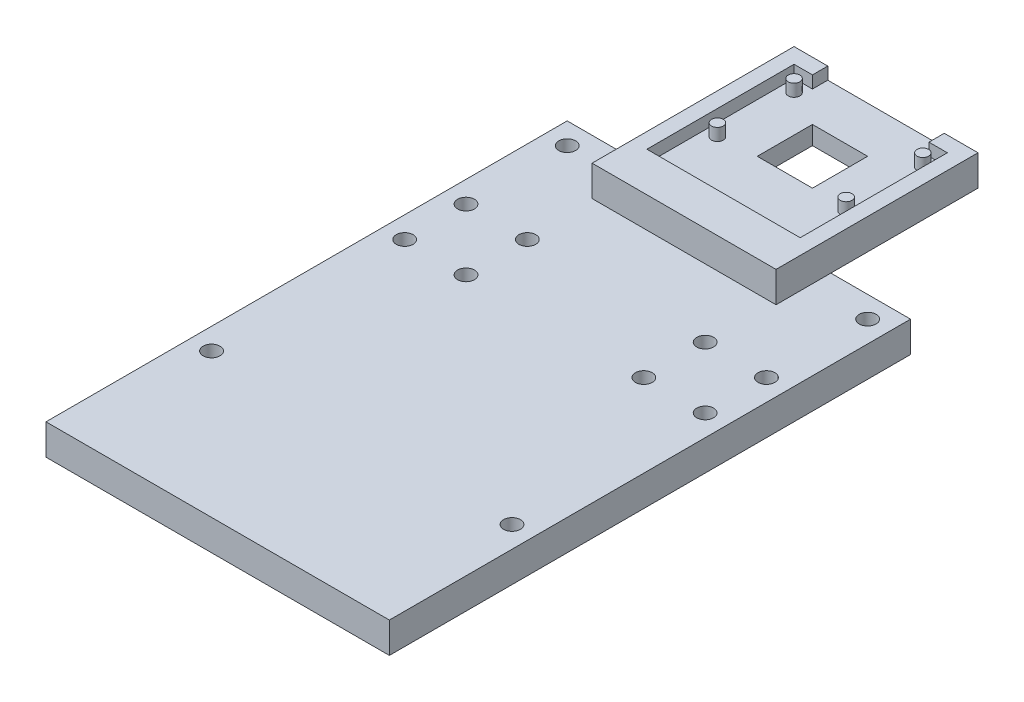
from build123d import *

# Parameters (mm, degrees)
SKETCH1_W           = 56
SKETCH1_H           = 85
BOSS_EXTRUDE1_DEPTH = 5
SKETCH2_R           = 1.375
CUT_EXTRUDE1_DEPTH  = 5
SKETCH3_R           = 1.375
CUT_EXTRUDE2_DEPTH  = 5
SKETCH5_W           = 30
SKETCH5_H           = 8.938360197
BOSS_EXTRUDE2_DEPTH = 5
SKETCH6_W           = 30
SKETCH6_H           = 5
BOSS_EXTRUDE3_DEPTH = 24
CUT_EXTRUDE3_DEPTH  = 2
SKETCH9_W           = 9
SKETCH9_H           = 9
CUT_EXTRUDE4_DEPTH  = 3
SKETCH10_R          = 0.95
BOSS_EXTRUDE4_DEPTH = 2


with BuildPart() as part:
    # Sketch1 → Boss-Extrude1 (new body)
    with BuildSketch(Plane(origin=(0, 0, 0), x_dir=(1, 0, 0), z_dir=(0, 1, 0))):
        with Locations((-25.952095808, 2.54491018)):
            Rectangle(SKETCH1_W, SKETCH1_H)
    extrude(amount=BOSS_EXTRUDE1_DEPTH)

    # Sketch2 → Cut-Extrude1 (cut)
    with BuildSketch(Plane(origin=(0, 0, 0), x_dir=(-1, 0, 0), z_dir=(0, -1, 0))):
        with Locations(Location((50.452095808, 41.54491018, 0), (0, 0, 90))):
            Circle(SKETCH2_R)
        with Locations(Location((1.452095808, 41.54491018, 0), (0, 0, 90))):
            Circle(SKETCH2_R)
        with Locations(Location((50.452095808, -16.45508982, 0), (0, 0, 90))):
            Circle(SKETCH2_R)
        with Locations(Location((1.452095808, -16.45508982, 0), (0, 0, 90))):
            Circle(SKETCH2_R)
    extrude(amount=-CUT_EXTRUDE1_DEPTH, mode=Mode.SUBTRACT)

    # Sketch3 → Cut-Extrude2 (cut)
    with BuildSketch(Plane(origin=(0, 0, 0), x_dir=(-1, 0, 0), z_dir=(0, -1, 0))):
        with Locations(Location((50.452095808, 25.04491018, 0), (0, 0, 90))):
            Circle(SKETCH3_R)
        with Locations(Location((50.452095808, 15.04491018, 0), (0, 0, 90))):
            Circle(SKETCH3_R)
        with Locations(Location((40.452095808, 15.04491018, 0), (0, 0, 90))):
            Circle(SKETCH3_R)
        with Locations(Location((40.452095808, 25.04491018, 0), (0, 0, 90))):
            Circle(SKETCH3_R)
        with Locations(Location((1.452095808, 25.04491018, 0), (0, 0, 90))):
            Circle(SKETCH3_R)
        with Locations(Location((11.452095808, 25.04491018, 0), (0, 0, 90))):
            Circle(SKETCH3_R)
        with Locations(Location((1.452095808, 15.04491018, 0), (0, 0, 90))):
            Circle(SKETCH3_R)
        with Locations(Location((11.452095808, 15.04491018, 0), (0, 0, 90))):
            Circle(SKETCH3_R)
    extrude(amount=-CUT_EXTRUDE2_DEPTH, mode=Mode.SUBTRACT)

    # Sketch5 → Boss-Extrude2 (add)
    with BuildSketch(Plane(origin=(0, 5, 0), x_dir=(1, 0, 0), z_dir=(0, 1, 0))):
        with Locations((-25.952095808, 40.575730081)):
            Rectangle(SKETCH5_W, SKETCH5_H)
    extrude(amount=BOSS_EXTRUDE2_DEPTH)

    # Sketch6 → Boss-Extrude3 (add)
    with BuildSketch(Plane(origin=(0, 0, -45.04491018), x_dir=(-1, 0, 0), z_dir=(0, 0, -1))):
        with Locations((25.952095808, 7.5)):
            Rectangle(SKETCH6_W, SKETCH6_H)
    extrude(amount=BOSS_EXTRUDE3_DEPTH)

    # Sketch8 → Cut-Extrude3 (cut)
    with BuildSketch(Plane(origin=(0, 10, 0), x_dir=(1, 0, 0), z_dir=(0, 1, 0))):
        Polygon((-38.452095808, 66.54491018), (-35.452095808, 66.54491018), (-35.452095808, 69.04491018), (-16.452095808, 69.04491018), (-16.452095808, 66.54491018), (-13.452095808, 66.54491018), (-13.452095808, 42.54491018), (-38.452095808, 42.54491018), align=None)
    extrude(amount=-CUT_EXTRUDE3_DEPTH, mode=Mode.SUBTRACT)

    # Sketch9 → Cut-Extrude4 (cut)
    with BuildSketch(Plane(origin=(0, 8, 0), x_dir=(1, 0, 0), z_dir=(0, 1, 0))):
        with Locations((-25.952095808, 57.04491018)):
            Rectangle(SKETCH9_W, SKETCH9_H)
    extrude(amount=-CUT_EXTRUDE4_DEPTH, mode=Mode.SUBTRACT)

    # Sketch10 → Boss-Extrude4 (add)
    with BuildSketch(Plane(origin=(0, 8, 0), x_dir=(1, 0, 0), z_dir=(0, 1, 0))):
        with Locations(Location((-36.452095808, 64.54491018, 0), (0, 0, 270))):
            Circle(SKETCH10_R)
        with Locations(Location((-15.452095808, 64.54491018, 0), (0, 0, 270))):
            Circle(SKETCH10_R)
        with Locations(Location((-15.452095808, 52.04491018, 0), (0, 0, 270))):
            Circle(SKETCH10_R)
        with Locations(Location((-36.452095808, 52.04491018, 0), (0, 0, 270))):
            Circle(SKETCH10_R)
    extrude(amount=BOSS_EXTRUDE4_DEPTH)


solid = part.part
